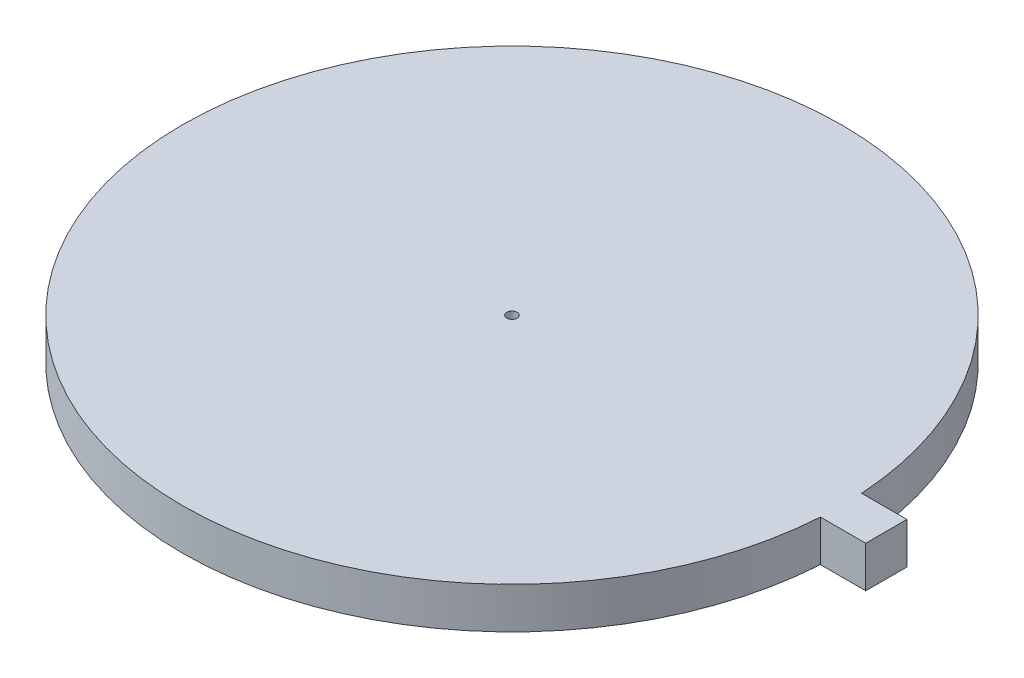
from build123d import *

# Parameters (mm, degrees)
SKETCH1_R           = 1.5875
BOSS_EXTRUDE1_DEPTH = 12.7


with BuildPart() as part:
    # Sketch1 → Boss-Extrude1 (new body)
    with BuildSketch(Plane(origin=(0, 0, 0), x_dir=(1, 0, 0), z_dir=(0, 1, 0))):
        with BuildLine():
            Line((115.371368334, -3.175), (115.371368334, 6.35))
            Line((115.371368334, 6.35), (101.401368334, 6.35))
            ThreePointArc((101.401368334, 6.35), (-101.6, 0), (101.401368334, -6.35))
            Line((101.401368334, -6.35), (115.371368334, -6.35))
            Line((115.371368334, -6.35), (115.371368334, -3.175))
        make_face()
        with Locations(Location((0, 0, 0), (0, 0, 270))):
            Circle(SKETCH1_R, mode=Mode.SUBTRACT)
    extrude(amount=BOSS_EXTRUDE1_DEPTH)


solid = part.part
